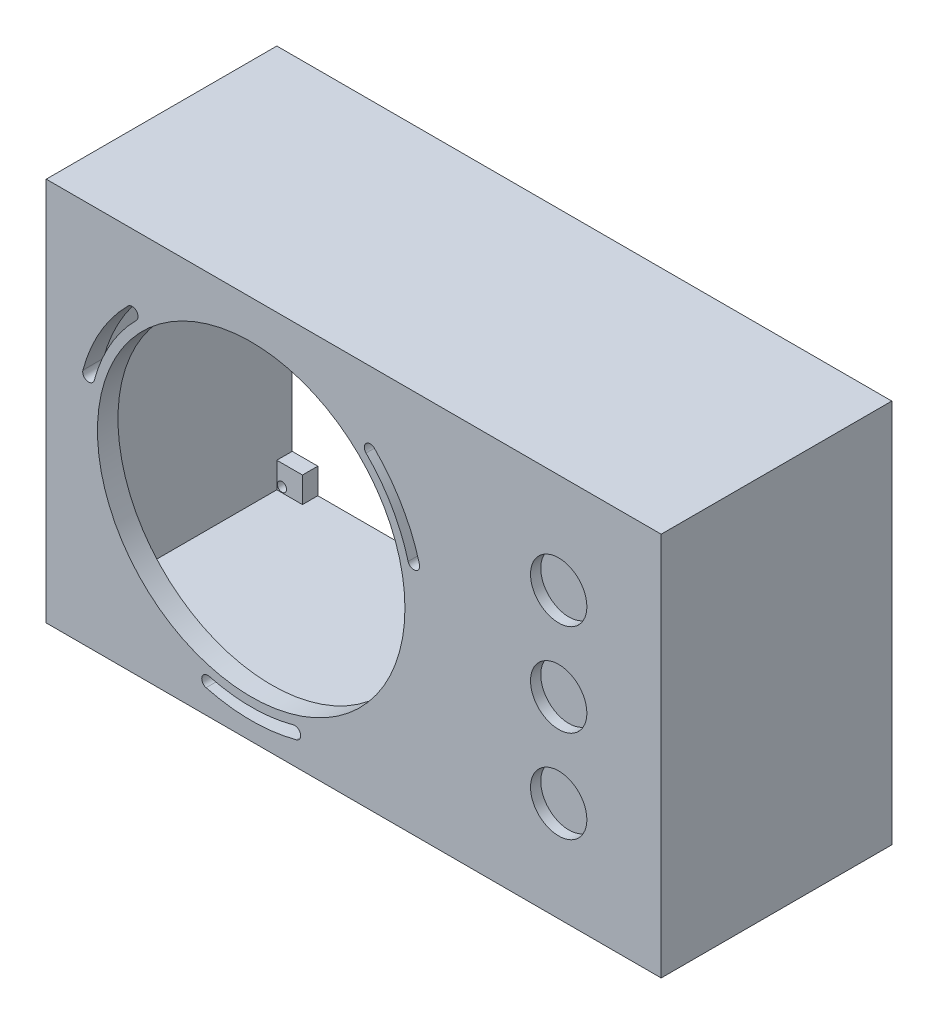
from build123d import *

# Parameters (mm, degrees)
SKETCH_1_W          = 120
SKETCH_1_H          = 75
SKETCH_1_W_2        = 114
SKETCH_1_H_2        = 69
EXTRUDE_1_DEPTH     = 45
SKETCH_2_R          = 30
EXTRUDE_2_DEPTH     = 4
CUT_EXTRUDE_1_DEPTH = 84.852549156
SKETCH_3_W          = 8
SKETCH_3_H          = 8
EXTRUDE_3_DEPTH     = 3
SKETCH_3_3_R        = 0.9
CUT_EXTRUDE_2_DEPTH = 3
SKETCH_4_R          = 5.5
CUT_EXTRUDE_3_DEPTH = 2


with BuildPart() as part:
    # 草图1 → 凸台-拉伸1 (new body)
    with BuildSketch(Plane.XY):
        Rectangle(SKETCH_1_W, SKETCH_1_H)
        Rectangle(SKETCH_1_W_2, SKETCH_1_H_2, mode=Mode.SUBTRACT)
    extrude(amount=EXTRUDE_1_DEPTH)

    # 草图2 → 凸台-拉伸2 (add)
    with BuildSketch(Plane.XY.offset(45)):
        Polygon((20, 37.5), (-60, 37.5), (-60, -37.5), (20, -37.5), (20, -34.5), (57, -34.5), (57, 34.5), (20, 34.5), align=None)
        with Locations((-20, 0)):
            Circle(SKETCH_2_R, mode=Mode.SUBTRACT)
    extrude(amount=-EXTRUDE_2_DEPTH)

    # 草图2<4> → 切除-拉伸1 (cut, through all)
    with BuildSketch(Plane.XY.offset(45)):
        with BuildLine():
            ThreePointArc((12.841478126, 8.799847414), (9.44486376, 16.999999947), (4.04163056, 24.04163056))
            ThreePointArc((4.04163056, 24.04163056), (2.415284962, 24.041630558), (2.415284968, 22.41528496))
            ThreePointArc((2.415284968, 22.41528496), (7.453005293, 15.850000012), (10.619848685, 8.204563761))
            ThreePointArc((10.619848685, 8.204563761), (12.02830522, 7.391390911), (12.841478126, 8.799847414))
        make_face()
        with BuildLine():
            ThreePointArc((-28.799847612, -32.841478073), (-20, -34), (-11.200152388, -32.841478073))
            ThreePointArc((-11.200152388, -32.841478073), (-10.386979697, -31.433021385), (-11.795436406, -30.61984873))
            ThreePointArc((-11.795436406, -30.61984873), (-20.000000038, -31.7), (-28.204563667, -30.61984871))
            ThreePointArc((-28.204563667, -30.61984871), (-29.613020313, -31.433021421), (-28.799847612, -32.841478073))
        make_face()
        with BuildLine():
            ThreePointArc((-44.04163056, 24.04163056), (-49.444863704, 17.000000043), (-52.841478068, 8.79984763))
            ThreePointArc((-52.841478068, 8.79984763), (-52.028305318, 7.391390937), (-50.61984868, 8.204563781))
            ThreePointArc((-50.61984868, 8.204563781), (-47.453005293, 15.850000012), (-42.415284981, 22.415284946))
            ThreePointArc((-42.415284981, 22.415284946), (-42.415284955, 24.041630551), (-44.04163056, 24.04163056))
        make_face()
    extrude(amount=-CUT_EXTRUDE_1_DEPTH, mode=Mode.SUBTRACT)

    # 草图3 → 凸台-拉伸3 (add)
    with BuildSketch(Plane(origin=(0, 0, 0), x_dir=(-1, 0, 0), z_dir=(0, 0, -1))):
        with Locations((-56, 33.5)):
            Rectangle(SKETCH_3_W, SKETCH_3_H)
        with Locations((56, 33.5)):
            Rectangle(SKETCH_3_W, SKETCH_3_H)
        with Locations((-56, -33.5)):
            Rectangle(SKETCH_3_W, SKETCH_3_H)
        with Locations((56, -33.5)):
            Rectangle(SKETCH_3_W, SKETCH_3_H)
    extrude(amount=-EXTRUDE_3_DEPTH)

    # 草图3<3> → 切除-拉伸2 (cut)
    with BuildSketch(Plane(origin=(0, 0, 0), x_dir=(-1, 0, 0), z_dir=(0, 0, -1))):
        with Locations((-56, 33.5)):
            Circle(SKETCH_3_3_R)
        with Locations((-56, -33.5)):
            Circle(SKETCH_3_3_R)
        with Locations((56, -33.5)):
            Circle(SKETCH_3_3_R)
        with Locations((56, 33.5)):
            Circle(SKETCH_3_3_R)
    extrude(amount=-CUT_EXTRUDE_2_DEPTH, mode=Mode.SUBTRACT)

    # 草图4 → 切除-拉伸3 (cut)
    with BuildSketch(Plane.XY.offset(45)):
        with Locations((40, 18)):
            Circle(SKETCH_4_R)
        with Locations((40, 0)):
            Circle(SKETCH_4_R)
        with Locations((40, -18)):
            Circle(SKETCH_4_R)
    extrude(amount=-CUT_EXTRUDE_3_DEPTH, mode=Mode.SUBTRACT)


solid = part.part
